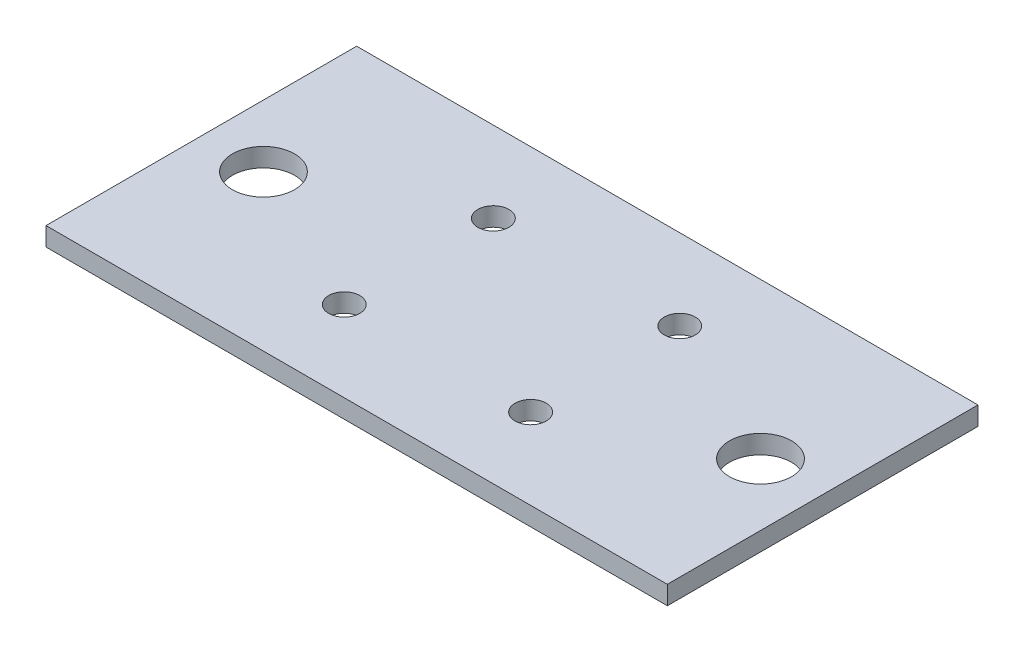
from build123d import *

# Parameters (mm, degrees)
SKETCH2_W           = 100
SKETCH2_H           = 50
BOSS_EXTRUDE2_DEPTH = 3
SKETCH5_R           = 5
SKETCH5_R_2         = 2.5
CUT_EXTRUDE1_DEPTH  = 3


with BuildPart() as part:
    # Sketch2 → Boss-Extrude2 (new body)
    with BuildSketch(Plane(origin=(0, 0, 0), x_dir=(1, 0, 0), z_dir=(0, 1, 0))):
        Rectangle(SKETCH2_W, SKETCH2_H)
    extrude(amount=BOSS_EXTRUDE2_DEPTH)

    # Sketch5 → Cut-Extrude1 (cut)
    with BuildSketch(Plane(origin=(0, 3, 0), x_dir=(1, 0, 0), z_dir=(0, 1, 0))):
        with Locations(Location((-40, 0, 0), (0, 0, 270))):
            Circle(SKETCH5_R)
        with Locations(Location((40, 0, 0), (0, 0, 270))):
            Circle(SKETCH5_R)
        with Locations(Location((-15, 12, 0), (0, 0, 270))):
            Circle(SKETCH5_R_2)
        with Locations(Location((-15, -12, 0), (0, 0, 270))):
            Circle(SKETCH5_R_2)
        with Locations(Location((15, 12, 0), (0, 0, 270))):
            Circle(SKETCH5_R_2)
        with Locations(Location((15, -12, 0), (0, 0, 270))):
            Circle(SKETCH5_R_2)
    extrude(amount=-CUT_EXTRUDE1_DEPTH, mode=Mode.SUBTRACT)


solid = part.part
